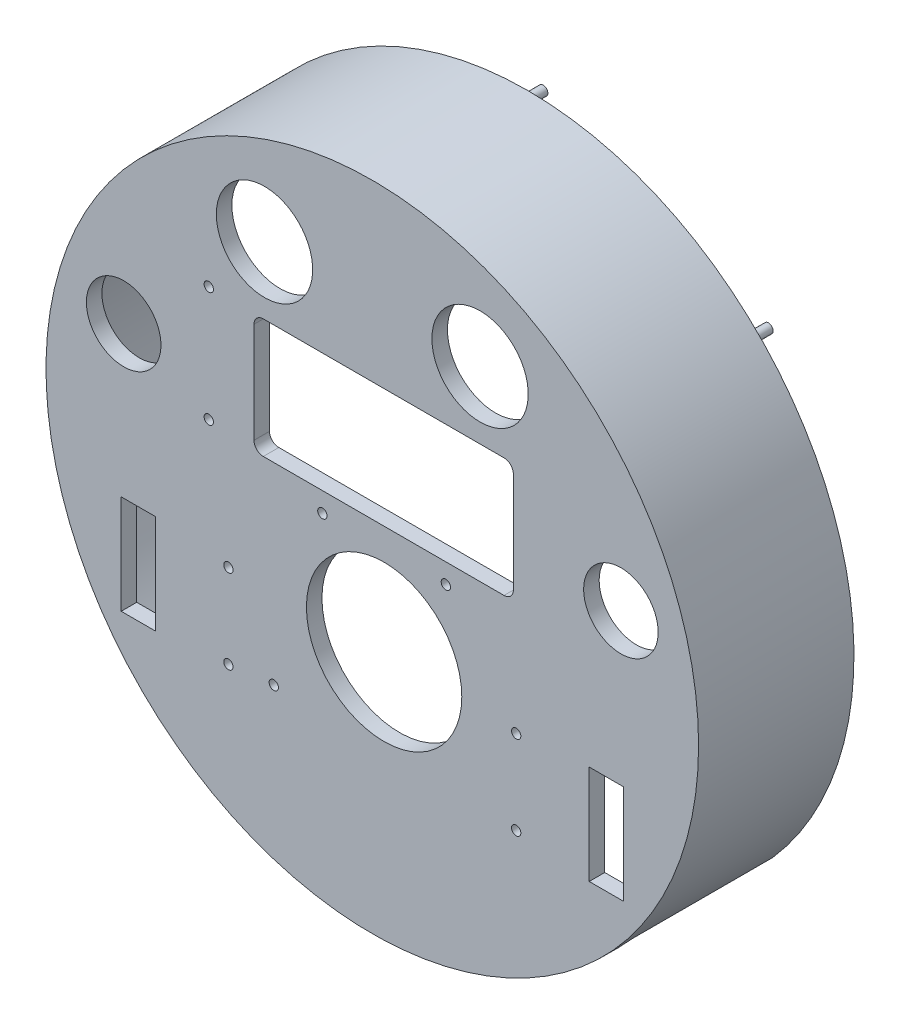
from build123d import *

# Parameters (mm, degrees)
ESQUISSE1_R             = 105
BOSS_EXTRU_1_DEPTH      = 50
COQUE1_T                = -5
ESQUISSE3_R             = 25
ESQUISSE3_R_2           = 1.5
ENL_V_MAT_EXTRU_1_DEPTH = 10
ENL_V_MAT_EXTRU_2_DEPTH = 156.161206492
ENL_V_MAT_EXTRU_3_DEPTH = 45
ESQUISSE7_R             = 1.5
ENL_V_MAT_EXTRU_4_DEPTH = 156.161206492
ESQUISSE8_W             = 11
ESQUISSE8_H             = 31.895350387
ENL_V_MAT_EXTRU_5_DEPTH = 5
ESQUISSE9_R             = 15.5
ENL_V_MAT_EXTRU_7_DEPTH = 156.161206492
BALAYAGE1_PROFILE_R     = 1.5
BOSS_EXTRU_2_START      = 1
BOSS_EXTRU_2_DEPTH      = 1
BALAYAGE2_PROFILE_R     = 1.5
BOSS_EXTRU_3_START      = 2
BOSS_EXTRU_3_DEPTH      = 2
ESQUISSE30_R            = 1.5
BOSS_EXTRU_4_DEPTH      = 5
ESQUISSE31_R            = 12
ENL_V_MAT_EXTRU_8_DEPTH = 5


with BuildPart() as part:
    # Esquisse1 → Boss.-Extru.1 (new body)
    with BuildSketch(Plane.XY):
        Circle(ESQUISSE1_R)
    extrude(amount=BOSS_EXTRU_1_DEPTH)

    # Coque1
    coque1_openings = [part.faces().sort_by_distance(p)[0] for p in [
        (0, 0, 0),
    ]]
    offset(amount=COQUE1_T, openings=coque1_openings, kind=Kind.INTERSECTION)

    # Esquisse3 → Enlèv. mat.-Extru.1 (cut)
    with BuildSketch(Plane(origin=(0, 0, 45), x_dir=(-1, 0, 0), z_dir=(0, 0, -1))):
        with Locations((-3.8, -24.557615642)):
            Circle(ESQUISSE3_R)
        with Locations((-23.669465397, 4.134521322)):
            Circle(ESQUISSE3_R_2)
        with Locations((16.069465397, 4.134521322)):
            Circle(ESQUISSE3_R_2)
        with Locations((31.7, -51.557615642)):
            Circle(ESQUISSE3_R_2)
    extrude(amount=-ENL_V_MAT_EXTRU_1_DEPTH, mode=Mode.SUBTRACT)

    # Esquisse5 → Enlèv. mat.-Extru.2 (cut, through all)
    with BuildSketch(Plane(origin=(0, 0, 45), x_dir=(-1, 0, 0), z_dir=(0, 0, -1))):
        with BuildLine():
            Line((-42.388918531, 10.472597699), (35.07440103, 10.472597699))
            ThreePointArc((35.07440103, 10.472597699), (37.195721374, 11.351277356), (38.07440103, 13.472597699))
            Line((38.07440103, 13.472597699), (38.07440103, 45.806945365))
            ThreePointArc((38.07440103, 45.806945365), (37.195721374, 47.928265708), (35.07440103, 48.806945365))
            Line((35.07440103, 48.806945365), (-42.388918531, 48.806945365))
            ThreePointArc((-42.388918531, 48.806945365), (-44.510238875, 47.928265708), (-45.388918531, 45.806945365))
            Line((-45.388918531, 45.806945365), (-45.388918531, 13.472597699))
            ThreePointArc((-45.388918531, 13.472597699), (-44.510238875, 11.351277356), (-42.388918531, 10.472597699))
        make_face()
    extrude(amount=-ENL_V_MAT_EXTRU_2_DEPTH, mode=Mode.SUBTRACT)

    # Esquisse6 → Enlèv. mat.-Extru.3 (cut)
    with BuildSketch(Plane(origin=(0, 0, 0), x_dir=(-1, 0, 0), z_dir=(0, 0, -1))):
        with BuildLine():
            Line((-78.81072608, -69.38205427), (78.81072608, -69.38205427))
            ThreePointArc((78.81072608, -69.38205427), (0, -105), (-78.81072608, -69.38205427))
        make_face()
    extrude(amount=-ENL_V_MAT_EXTRU_3_DEPTH, mode=Mode.SUBTRACT)

    # Esquisse7 → Enlèv. mat.-Extru.4 (cut, through all)
    with BuildSketch(Plane(origin=(0, 0, 45), x_dir=(-1, 0, 0), z_dir=(0, 0, -1))):
        with Locations((52.614229855, 48.990085475)):
            Circle(ESQUISSE7_R)
        with Locations((52.614229855, 11.990085475)):
            Circle(ESQUISSE7_R)
        with Locations((46.3, -26.057615642)):
            Circle(ESQUISSE7_R)
        with Locations((46.3, -53.057615642)):
            Circle(ESQUISSE7_R)
        with Locations((-46.3, -26.062213408)):
            Circle(ESQUISSE7_R)
        with Locations((-46.3, -53.062213408)):
            Circle(ESQUISSE7_R)
    extrude(amount=-ENL_V_MAT_EXTRU_4_DEPTH, mode=Mode.SUBTRACT)

    # Esquisse8 → Enlèv. mat.-Extru.5 (cut)
    with BuildSketch(Plane(origin=(0, 0, 45), x_dir=(-1, 0, 0), z_dir=(0, 0, -1))):
        with Locations((-75.3, -39.589403314)):
            Rectangle(ESQUISSE8_W, ESQUISSE8_H)
        with Locations((75.3, -39.589403314)):
            Rectangle(ESQUISSE8_W, ESQUISSE8_H)
    extrude(amount=-ENL_V_MAT_EXTRU_5_DEPTH, mode=Mode.SUBTRACT)

    # Esquisse9 → Enlèv. mat.-Extru.7 (cut, through all)
    with BuildSketch(Plane(origin=(0, 0, 45), x_dir=(-1, 0, 0), z_dir=(0, 0, -1))):
        with Locations((34.681880454, 70.440085475)):
            Circle(ESQUISSE9_R)
        with Locations((-34.681880454, 70.440085475)):
            Circle(ESQUISSE9_R)
    extrude(amount=-ENL_V_MAT_EXTRU_7_DEPTH, mode=Mode.SUBTRACT)

    # Balayage1: sweep along a path in Esquisse10
    with BuildLine(Plane(origin=(-9.681880454, 0.440085475, 22), x_dir=(-1, 0, 0), z_dir=(0, 0, -1))) as balayage1_path:
        Line((-43.221417057, 88.965628134), (-42.925873334, 93.872357698))
    # Balayage1 profile (on start of the path) → Balayage1 (sweep)
    with BuildSketch(Plane(origin=(33.539536603, 89.405713609, 22), x_dir=(0.9981909544337458, 0.060123360573471965, 0), z_dir=(-0.060123360573471965, 0.9981909544337458, 0))):
        Circle(BALAYAGE1_PROFILE_R)
    balayage1 = sweep(path=balayage1_path.line)

    # Esquisse19 → Boss.-Extru.2 (add)
    with BuildSketch(Plane(origin=(-5.53995205, 91.976396052, 0), x_dir=(0.998190954433746, 0.06012336057346903, 0), z_dir=(-0.06012336057346903, 0.998190954433746, 0)).offset(BOSS_EXTRU_2_START)):
        with BuildLine():
            Line((38.85423401, -23.5), (38.85423401, -20.5))
            ThreePointArc((38.85423401, -20.5), (37.35423401, -22), (38.85423401, -23.5))
        make_face()
    boss_extru_2 = extrude(amount=-BOSS_EXTRU_2_DEPTH)

    # Balayage2: sweep along a path in Esquisse20
    with BuildLine(Plane(origin=(-9.681880454, 0.440085475, 22), x_dir=(-1, 0, 0), z_dir=(0, 0, -1))) as balayage2_path:
        Line((-73.311298587, 71.743577457), (-78.469516131, 72.142702967))
    # Balayage2 profile (on start of the path) → Balayage2 (sweep)
    with BuildSketch(Plane(origin=(63.629418133, 72.183662932, 22), x_dir=(-0.07714603625431019, 0.9970198037603109, 0), z_dir=(0.9970198037603109, 0.07714603625431019, 0))):
        Circle(BALAYAGE2_PROFILE_R)
    balayage2 = sweep(path=balayage2_path.line)

    # Esquisse27 → Boss.-Extru.3 (add)
    with BuildSketch(Plane(origin=(73.961032209, 5.722855705, 0), x_dir=(0, 0, -1), z_dir=(0.9970198037603113, 0.07714603625430425, 0)).offset(BOSS_EXTRU_3_START)):
        with BuildLine():
            Line((-20.5, 67.059784053), (-23.5, 67.059784053))
            ThreePointArc((-23.5, 67.059784053), (-22, 65.559784053), (-20.5, 67.059784053))
        make_face()
    boss_extru_3 = extrude(amount=-BOSS_EXTRU_3_DEPTH)

    # Symétrie1: Balayage1, Boss.-Extru.2, Balayage2, Boss.-Extru.3 across plane
    add(balayage1.mirror(Plane(origin=(0, 0, 0), x_dir=(0, 0, 1), z_dir=(1, 0, 0))))
    add(boss_extru_2.mirror(Plane(origin=(0, 0, 0), x_dir=(0, 0, 1), z_dir=(1, 0, 0))))
    add(balayage2.mirror(Plane(origin=(0, 0, 0), x_dir=(0, 0, 1), z_dir=(1, 0, 0))))
    add(boss_extru_3.mirror(Plane(origin=(0, 0, 0), x_dir=(0, 0, 1), z_dir=(1, 0, 0))))

    # Esquisse30 → Boss.-Extru.4 (add)
    with BuildSketch(Plane(origin=(0, 0, 0), x_dir=(-1, 0, 0), z_dir=(0, 0, -1))):
        with Locations(Location((0, 102.5, 0), (0, 0, 180))):
            Circle(ESQUISSE30_R)
        with Locations(Location((-72.478445072, 72.478445072, 0), (0, 0, 180))):
            Circle(ESQUISSE30_R)
        with Locations((72.478445072, 72.478445072)):
            Circle(ESQUISSE30_R)
    extrude(amount=BOSS_EXTRU_4_DEPTH)

    # Esquisse31 → Enlèv. mat.-Extru.8 (cut)
    with BuildSketch(Plane(origin=(0, 0, 45), x_dir=(-1, 0, 0), z_dir=(0, 0, -1))):
        with Locations((-80, 25)):
            Circle(ESQUISSE31_R)
        with Locations((80, 25)):
            Circle(ESQUISSE31_R)
    extrude(amount=-ENL_V_MAT_EXTRU_8_DEPTH, mode=Mode.SUBTRACT)


solid = part.part
